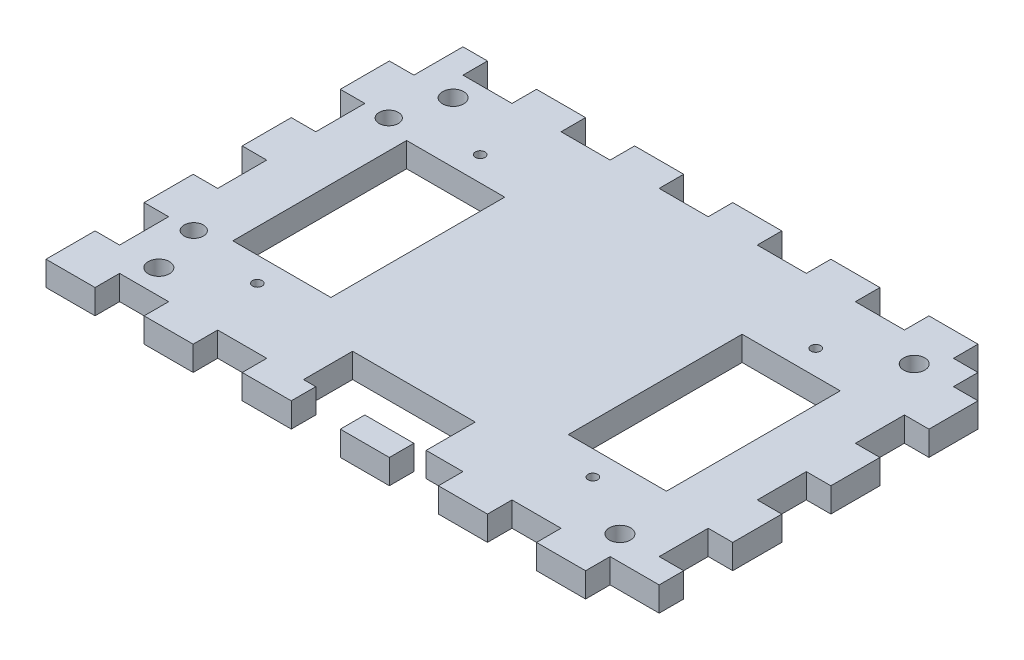
from build123d import *

# Parameters (mm, degrees)
SKETCH1_W                            = 152.4
SKETCH1_H                            = 101.6
BOSS_EXTRUDE2_DEPTH                  = 6.35
SKETCH2_W                            = 6.35
SKETCH2_H                            = 12.7
CUT_EXTRUDE2_DEPTH                   = 6.35
SKETCH2_4_W                          = 12.7
SKETCH2_4_H                          = 6.35
CUT_EXTRUDE3_DEPTH                   = 6.35
SKETCH9_W                            = 25.4
SKETCH9_H                            = 45
CUT_EXTRUDE4_DEPTH                   = 184.272045059
SKETCH12_W                           = 31.75
SKETCH12_H                           = 12.7
CUT_EXTRUDE6_DEPTH                   = 184.272045059
SKETCH17_W                           = 1.25
SKETCH17_H                           = 6.35
TAP_DRILL_FOR_M3X0_5_TAP1_AT_2_COUNT = 2
TAP_DRILL_FOR_M3X0_5_TAP1_AT_2_PITCH = 57.7
TAP_DRILL_FOR_M3X0_5_TAP1_AT_3_COUNT = 2
TAP_DRILL_FOR_M3X0_5_TAP1_AT_3_PITCH = 104.284895474
TAP_DRILL_FOR_M3X0_5_TAP1_AT_4_COUNT = 2
TAP_DRILL_FOR_M3X0_5_TAP1_AT_4_PITCH = 86.868
SKETCH19_W                           = 2.75
SKETCH19_H                           = 6.35
M5_CLEARANCE_HOLE1_AT_2_COUNT        = 2
M5_CLEARANCE_HOLE1_AT_2_PITCH        = 119.38
M5_CLEARANCE_HOLE1_AT_3_COUNT        = 2
M5_CLEARANCE_HOLE1_AT_3_PITCH        = 141.626354892
M5_CLEARANCE_HOLE1_AT_4_COUNT        = 2
M5_CLEARANCE_HOLE1_AT_4_PITCH        = 76.2
SKETCH21_W                           = 2.5
SKETCH21_H                           = 6.35
F_5_0MM_DOWEL_HOLE3_AT_2_COUNT       = 2
F_5_0MM_DOWEL_HOLE3_AT_2_PITCH       = 50.48


with BuildPart() as part:
    # Sketch1 → Boss-Extrude2 (new body)
    with BuildSketch(Plane(origin=(0, 0, 0), x_dir=(1, 0, 0), z_dir=(0, 1, 0))):
        with Locations((76.2, 50.8)):
            Rectangle(SKETCH1_W, SKETCH1_H)
    extrude(amount=BOSS_EXTRUDE2_DEPTH)

    # Sketch2 → Cut-Extrude2 (cut)
    with BuildSketch(Plane(origin=(0, 6.35, 0), x_dir=(1, 0, 0), z_dir=(0, 1, 0))):
        with Locations((3.175, 95.25)):
            Rectangle(SKETCH2_W, SKETCH2_H)
        with Locations((3.175, 69.85)):
            Rectangle(SKETCH2_W, SKETCH2_H)
        with Locations((3.175, 44.45)):
            Rectangle(SKETCH2_W, SKETCH2_H)
        with Locations((3.175, 19.05)):
            Rectangle(SKETCH2_W, SKETCH2_H)
    cut_extrude2 = extrude(amount=-CUT_EXTRUDE2_DEPTH, mode=Mode.SUBTRACT)

    # Mirror1: Cut-Extrude2 across plane
    add(cut_extrude2.mirror(Plane.ZY.offset(-76.2)), mode=Mode.SUBTRACT)

    # Sketch2<4> → Cut-Extrude3 (cut)
    with BuildSketch(Plane(origin=(0, 6.35, 0), x_dir=(1, 0, 0), z_dir=(0, 1, 0))):
        with Locations((19.05, 98.425)):
            Rectangle(SKETCH2_4_W, SKETCH2_4_H)
        with Locations((44.45, 98.425)):
            Rectangle(SKETCH2_4_W, SKETCH2_4_H)
        with Locations((69.85, 98.425)):
            Rectangle(SKETCH2_4_W, SKETCH2_4_H)
        with Locations((95.25, 98.425)):
            Rectangle(SKETCH2_4_W, SKETCH2_4_H)
        with Locations((146.05, 98.425)):
            Rectangle(SKETCH2_4_W, SKETCH2_4_H)
        with Locations((120.65, 98.425)):
            Rectangle(SKETCH2_4_W, SKETCH2_4_H)
    cut_extrude3 = extrude(amount=-CUT_EXTRUDE3_DEPTH, mode=Mode.SUBTRACT)

    # Mirror2: Cut-Extrude3 across plane
    add(cut_extrude3.mirror(Plane(origin=(0, 0, -50.8), x_dir=(1, 0, 0), z_dir=(0, 0, -1))), mode=Mode.SUBTRACT)

    # Sketch9 → Cut-Extrude4 (cut, through all)
    with BuildSketch(Plane(origin=(0, 6.35, 0), x_dir=(1, 0, 0), z_dir=(0, 1, 0))):
        with Locations((32.766, 50.8)):
            Rectangle(SKETCH9_W, SKETCH9_H)
        with Locations((119.634, 50.8)):
            Rectangle(SKETCH9_W, SKETCH9_H)
    extrude(amount=-CUT_EXTRUDE4_DEPTH, mode=Mode.SUBTRACT)

    # Sketch12 → Cut-Extrude6 (cut, through all)
    with BuildSketch(Plane(origin=(0, 6.35, 0), x_dir=(1, 0, 0), z_dir=(0, 1, 0))):
        with Locations((76.2, 12.7)):
            Rectangle(SKETCH12_W, SKETCH12_H)
    extrude(amount=-CUT_EXTRUDE6_DEPTH, mode=Mode.SUBTRACT)


with BuildPart() as cut_extrude6_piece_1:
    # of the separate pieces the step leaves, piece 1, a body of its own (cut_extrude6_pieces)
    add(part.part.solids().sort_by_distance((0, 0, -88.9))[0])

    # Sketch17 → Tap Drill for M3x0.5 Tap1 (revolve, cut)
    with BuildSketch(Plane(origin=(32.766, 6.35, -79.65), x_dir=(0, 0, 1), z_dir=(1, 0, 0))):
        with Locations((0.625, 3.175)):
            Rectangle(SKETCH17_W, SKETCH17_H)
    tap_drill_for_m3x0_5_tap1 = revolve(axis=Axis((32.766, 12.7, -79.65), (0, -1, 0)), mode=Mode.SUBTRACT)

    # Tap Drill for M3x0.5 Tap1 at 2: Tap Drill for M3x0.5 Tap1 ×2
    with Locations(*[(0, 0, i * TAP_DRILL_FOR_M3X0_5_TAP1_AT_2_PITCH) for i in range(1, TAP_DRILL_FOR_M3X0_5_TAP1_AT_2_COUNT)]):
        add(tap_drill_for_m3x0_5_tap1, mode=Mode.SUBTRACT)

    # Tap Drill for M3x0.5 Tap1 at 3: Tap Drill for M3x0.5 Tap1 ×2
    with Locations(*[Vector(0.8329873622182414, 0, 0.5532920154716644) * (i * TAP_DRILL_FOR_M3X0_5_TAP1_AT_3_PITCH) for i in range(1, TAP_DRILL_FOR_M3X0_5_TAP1_AT_3_COUNT)]):
        add(tap_drill_for_m3x0_5_tap1, mode=Mode.SUBTRACT)

    # Tap Drill for M3x0.5 Tap1 at 4: Tap Drill for M3x0.5 Tap1 ×2
    with Locations(*[(i * TAP_DRILL_FOR_M3X0_5_TAP1_AT_4_PITCH, 0, 0) for i in range(1, TAP_DRILL_FOR_M3X0_5_TAP1_AT_4_COUNT)]):
        add(tap_drill_for_m3x0_5_tap1, mode=Mode.SUBTRACT)

    # Sketch19 → M5 Clearance Hole1 (revolve, cut)
    with BuildSketch(Plane(origin=(16.51, 6.35, -88.9), x_dir=(0, 0, 1), z_dir=(1, 0, 0))):
        with Locations((1.375, 3.175)):
            Rectangle(SKETCH19_W, SKETCH19_H)
    m5_clearance_hole1 = revolve(axis=Axis((16.51, 12.7, -88.9), (0, -1, 0)), mode=Mode.SUBTRACT)

    # M5 Clearance Hole1 at 2: M5 Clearance Hole1 ×2
    with Locations(*[(i * M5_CLEARANCE_HOLE1_AT_2_PITCH, 0, 0) for i in range(1, M5_CLEARANCE_HOLE1_AT_2_COUNT)]):
        add(m5_clearance_hole1, mode=Mode.SUBTRACT)

    # M5 Clearance Hole1 at 3: M5 Clearance Hole1 ×2
    with Locations(*[Vector(0.8429222095775885, 0, 0.5380354529218647) * (i * M5_CLEARANCE_HOLE1_AT_3_PITCH) for i in range(1, M5_CLEARANCE_HOLE1_AT_3_COUNT)]):
        add(m5_clearance_hole1, mode=Mode.SUBTRACT)

    # M5 Clearance Hole1 at 4: M5 Clearance Hole1 ×2
    with Locations(*[(0, 0, i * M5_CLEARANCE_HOLE1_AT_4_PITCH) for i in range(1, M5_CLEARANCE_HOLE1_AT_4_COUNT)]):
        add(m5_clearance_hole1, mode=Mode.SUBTRACT)

    # Sketch21 → Ø5.0mm Dowel Hole3 (revolve, cut)
    with BuildSketch(Plane(origin=(12.7, 0, -76.04), x_dir=(0, 0, -1), z_dir=(1, 0, 0))):
        with Locations((1.25, 3.175)):
            Rectangle(SKETCH21_W, SKETCH21_H)
    f_5_0mm_dowel_hole3 = revolve(axis=Axis((12.7, -6.35, -76.04), (0, 1, 0)), mode=Mode.SUBTRACT)

    # Ø5.0mm Dowel Hole3 at 2: Ø5.0mm Dowel Hole3 ×2
    with Locations(*[(0, 0, i * F_5_0MM_DOWEL_HOLE3_AT_2_PITCH) for i in range(1, F_5_0MM_DOWEL_HOLE3_AT_2_COUNT)]):
        add(f_5_0mm_dowel_hole3, mode=Mode.SUBTRACT)


with BuildPart() as cut_extrude6_piece_2:
    # of the separate pieces the step leaves, piece 2, a body of its own (cut_extrude6_pieces)
    add(part.part.solids().sort_by_distance((88.9, 0, -6.35))[0])


solid = Compound([cut_extrude6_piece_1.part, cut_extrude6_piece_2.part])
